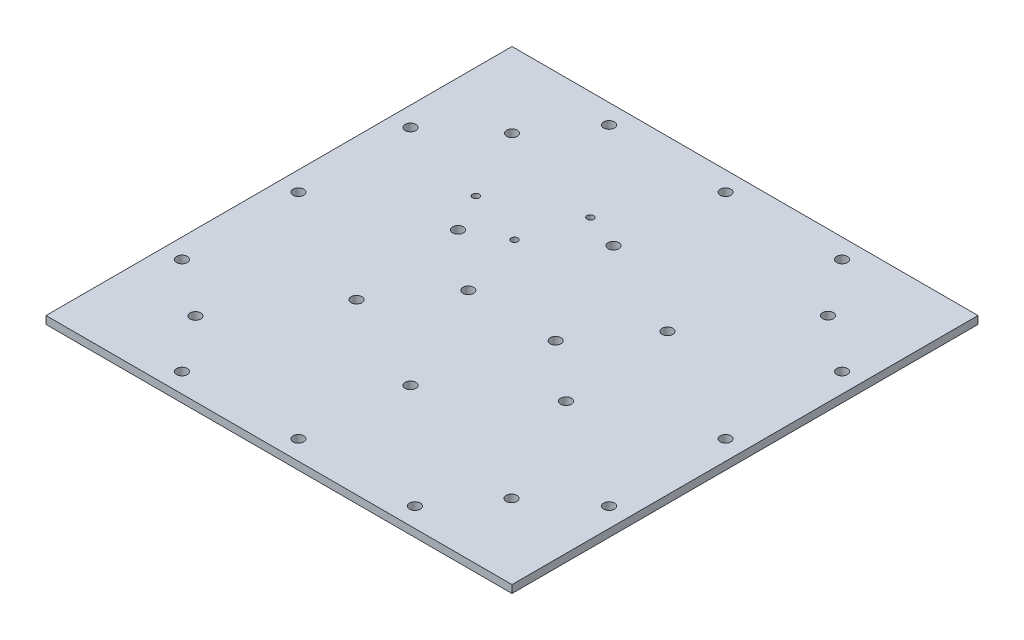
from build123d import *

# Parameters (mm, degrees)
SKETCH1_W            = 240
SKETCH1_H            = 240
BOSS_EXTRUDE1_DEPTH  = 4
M5_CLEARANCE_HOLE1_D = 5.5
M3_CLEARANCE_HOLE1_D = 3.4


with BuildPart() as part:
    # Sketch1 → Boss-Extrude1 (new body)
    with BuildSketch(Plane(origin=(0, 0, 0), x_dir=(1, 0, 0), z_dir=(0, 1, 0))):
        with Locations((100, 100)):
            Rectangle(SKETCH1_W, SKETCH1_H)
    extrude(amount=BOSS_EXTRUDE1_DEPTH)

    # M5 Clearance Hole1 (through all)
    with Locations(Plane(origin=(0, 4, 0), x_dir=(1, 0, 0), z_dir=(0, 1, 0))):
        with Locations((18.682720164, 181.317279836), (181.436841233, 181.317279836), (181.436841233, 18.3), (18.682720164, 18.3), (40, 210), (100, 210), (160, 210), (210, 160), (210, 100), (210, 40), (160, -10), (100, -10), (40, -10), (-10, 40), (-10, 100), (-10, 157.735112715), (94.988544792, 157.28119514), (47.887302245, 124.30055005), (105.011455208, 42.71880486), (147.101242547, 132.98064509), (152.112697755, 75.69944995), (52.898757453, 67.01935491), (77.5, 100), (122.5, 100)):
            Hole(M5_CLEARANCE_HOLE1_D / 2)

    # M3 Clearance Hole1 (through all)
    with Locations(Plane(origin=(0, 4, 0), x_dir=(1, 0, 0), z_dir=(0, 1, 0))):
        with Locations((37.378342924, 144.00490984), (76.440621755, 163.90813502), (66.861094929, 134.425383015)):
            Hole(M3_CLEARANCE_HOLE1_D / 2)


solid = part.part
